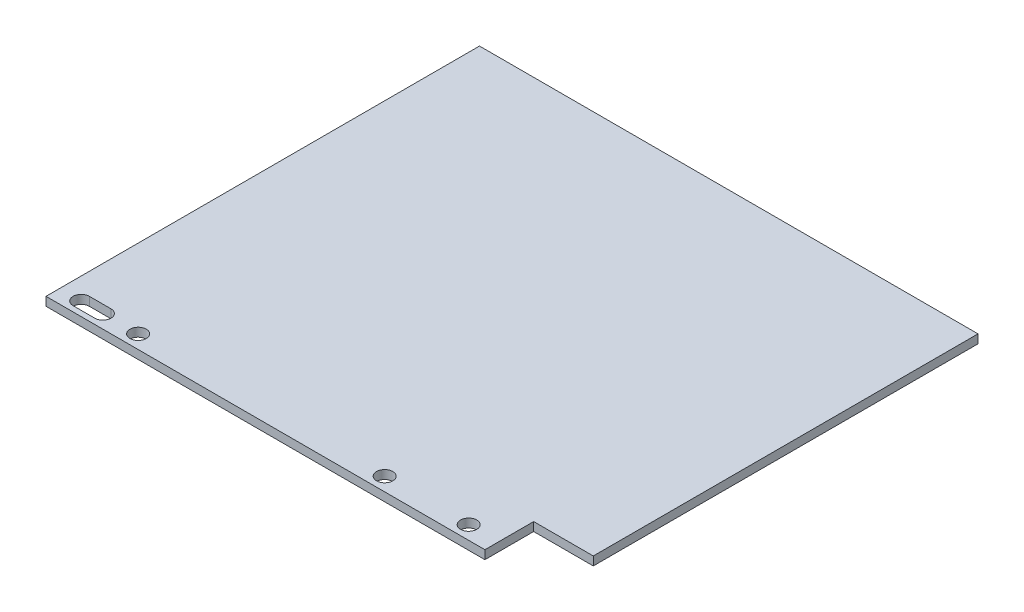
from build123d import *

# Parameters (mm, degrees)
SKETCH1_R           = 1.5
BOSS_EXTRUDE1_DEPTH = 1.6


with BuildPart() as part:
    # Sketch1 → Boss-Extrude1 (new body)
    with BuildSketch(Plane(origin=(0, 0, 0), x_dir=(1, 0, 0), z_dir=(0, 1, 0))):
        Polygon((46, -28.808269535), (35, -28.808269535), (35, -37.808269535), (-46, -37.808269535), (-46, 42.191730465), (46, 42.191730465), align=None)
        with Locations(Location((29.5, -35.308269535, 0), (0, 0, 270))):
            Circle(SKETCH1_R, mode=Mode.SUBTRACT)
        with Locations(Location((14, -35.308269535, 0), (0, 0, 270))):
            Circle(SKETCH1_R, mode=Mode.SUBTRACT)
        with Locations(Location((-31.5, -35.308269535, 0), (0, 0, 270))):
            Circle(SKETCH1_R, mode=Mode.SUBTRACT)
        with BuildLine():
            Line((-38, -36.808269535), (-42, -36.808269535))
            ThreePointArc((-42, -36.808269535), (-43.5, -35.308269535), (-42, -33.808269535))
            Line((-42, -33.808269535), (-38, -33.808269535))
            ThreePointArc((-38, -33.808269535), (-36.5, -35.308269535), (-38, -36.808269535))
        make_face(mode=Mode.SUBTRACT)
    extrude(amount=BOSS_EXTRUDE1_DEPTH)


solid = part.part
